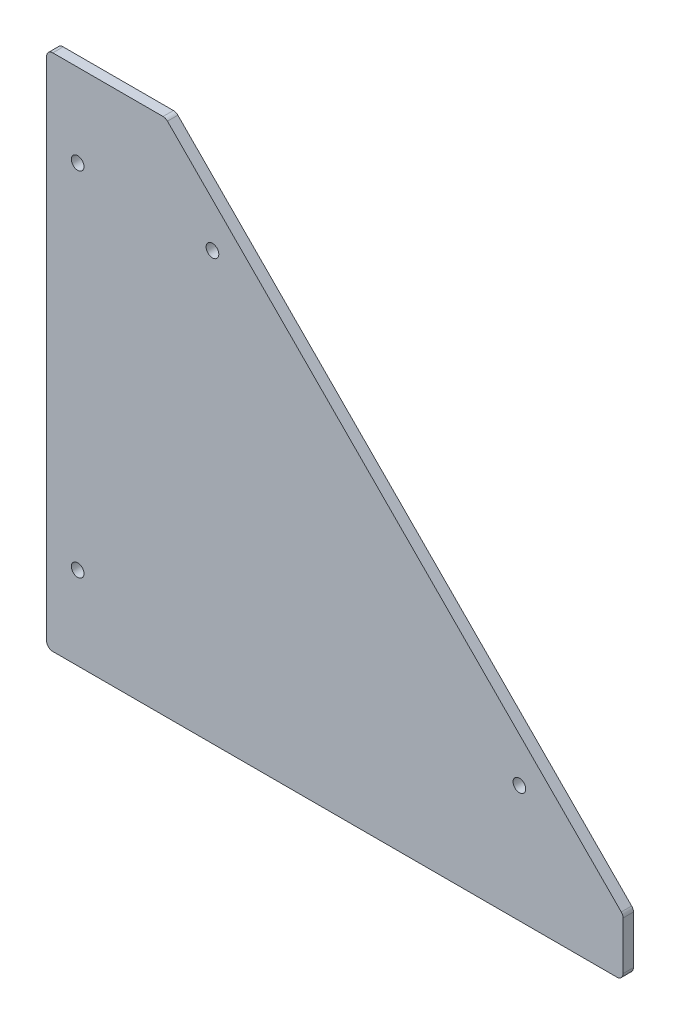
from build123d import *

# Parameters (mm, degrees)
SKETCH1_R           = 3.05
BOSS_EXTRUDE1_DEPTH = 5
FILLET1_R           = 3


with BuildPart() as part:
    # Sketch1 → Boss-Extrude1 (new body)
    with BuildSketch(Plane.XY):
        Polygon((0, 0), (0, 250), (57.43, 250), (278, 27.43), (278, 0), align=None)
        with Locations((15, 210)):
            Circle(SKETCH1_R, mode=Mode.SUBTRACT)
        with Locations((15, 40)):
            Circle(SKETCH1_R, mode=Mode.SUBTRACT)
        with Locations((80, 205.915753479)):
            Circle(SKETCH1_R, mode=Mode.SUBTRACT)
        with Locations((228, 56.573775875)):
            Circle(SKETCH1_R, mode=Mode.SUBTRACT)
    extrude(amount=BOSS_EXTRUDE1_DEPTH)

    # Fillet1
    fillet1_edges = [part.edges().sort_by_distance(p)[0] for p in [
        (0, 0, 2.5),
        (0, 250, 2.5),
        (57.43, 250, 2.5),
        (278, 27.43, 2.5),
        (278, 0, 2.5),
    ]]
    fillet(fillet1_edges, radius=FILLET1_R)


solid = part.part
